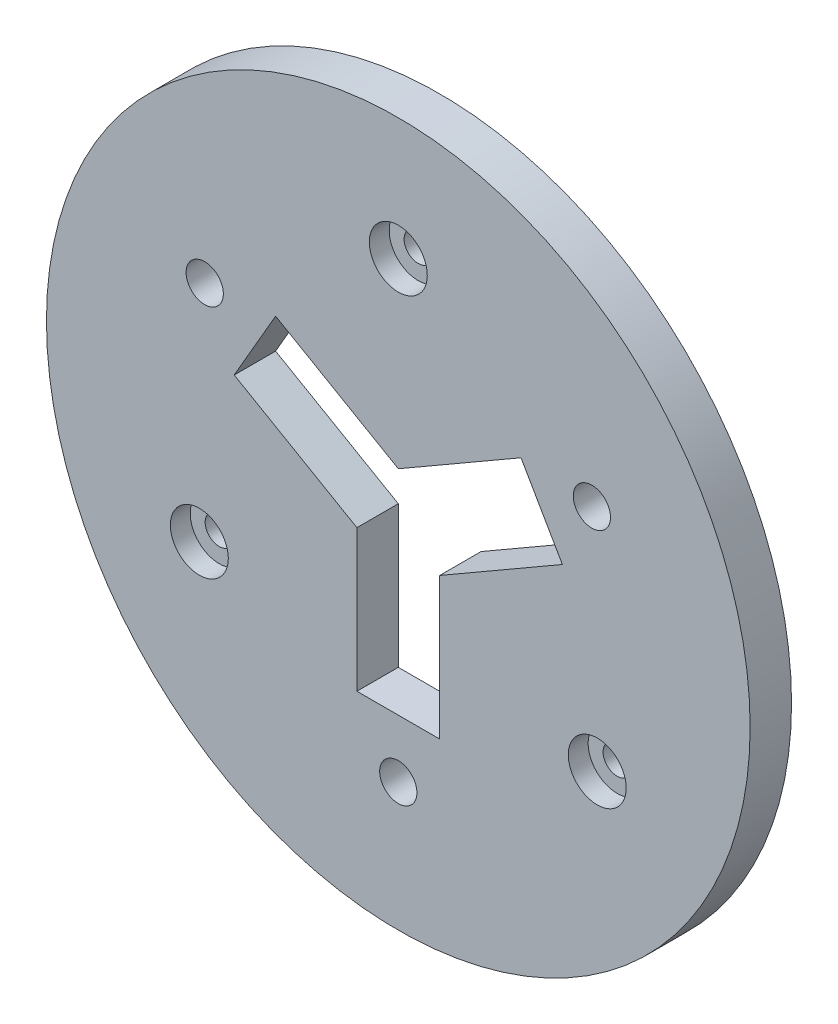
from build123d import *

# Parameters (mm, degrees)
CROQUIS1_R                                           = 42.5
SALIENTE_EXTRUIR1_DEPTH                              = 2.5
REFRENTADO_PARA_TORNILLO_CON_CABEZA_TRON_D           = 3.4
REFRENTADO_PARA_TORNILLO_CON_CABEZA_TRON_CBORE_D     = 7
REFRENTADO_PARA_TORNILLO_CON_CABEZA_TRON_CBORE_DEPTH = 2.4
TALADRO_DE_MARGEN_PARA_M41_D                         = 4.5
CORTAR_EXTRUIR1_REACH                                = 62.312


with BuildPart() as part:
    # Croquis1 → Saliente-Extruir1 (new, symmetric)
    with BuildSketch(Plane.XY):
        Circle(CROQUIS1_R)
    extrude(amount=SALIENTE_EXTRUIR1_DEPTH, both=True)

    # Refrentado para tornillo con cabeza troncocónica de M31 (through all)
    with Locations(Plane.XY.offset(2.5)):
        with Locations((0, 27.75), (24.032204955, -13.875), (-24.032204955, -13.875)):
            CounterBoreHole(REFRENTADO_PARA_TORNILLO_CON_CABEZA_TRON_D / 2, REFRENTADO_PARA_TORNILLO_CON_CABEZA_TRON_CBORE_D / 2, REFRENTADO_PARA_TORNILLO_CON_CABEZA_TRON_CBORE_DEPTH)

    # Taladro de margen para M41 (through all)
    with Locations(Plane.XY.offset(2.5)):
        with Locations((0, -27), (-23.382685902, 13.5), (23.382685902, 13.5)):
            Hole(TALADRO_DE_MARGEN_PARA_M41_D / 2)

    # Croquis8 → Cortar-Extruir1 (cut, up to next)
    with BuildSketch(Plane.XY.offset(2.5), mode=Mode.PRIVATE) as cortar_extruir1_sk1:
        Polygon((-14.820508076, 14.330127019), (0, 5.773502692), (14.820508076, 14.330127019), (19.820508076, 5.669872981), (5, -2.886751346), (5, -20), (-5, -20), (-5, -2.886751346), (-19.820508076, 5.669872981), align=None)
    cortar_extruir1_tool1 = extrude(cortar_extruir1_sk1.sketch, amount=-CORTAR_EXTRUIR1_REACH, mode=Mode.PRIVATE) & part.part
    add(cortar_extruir1_tool1.solids().sort_by_distance((0, 0, 2.5))[0], mode=Mode.SUBTRACT)


solid = part.part
